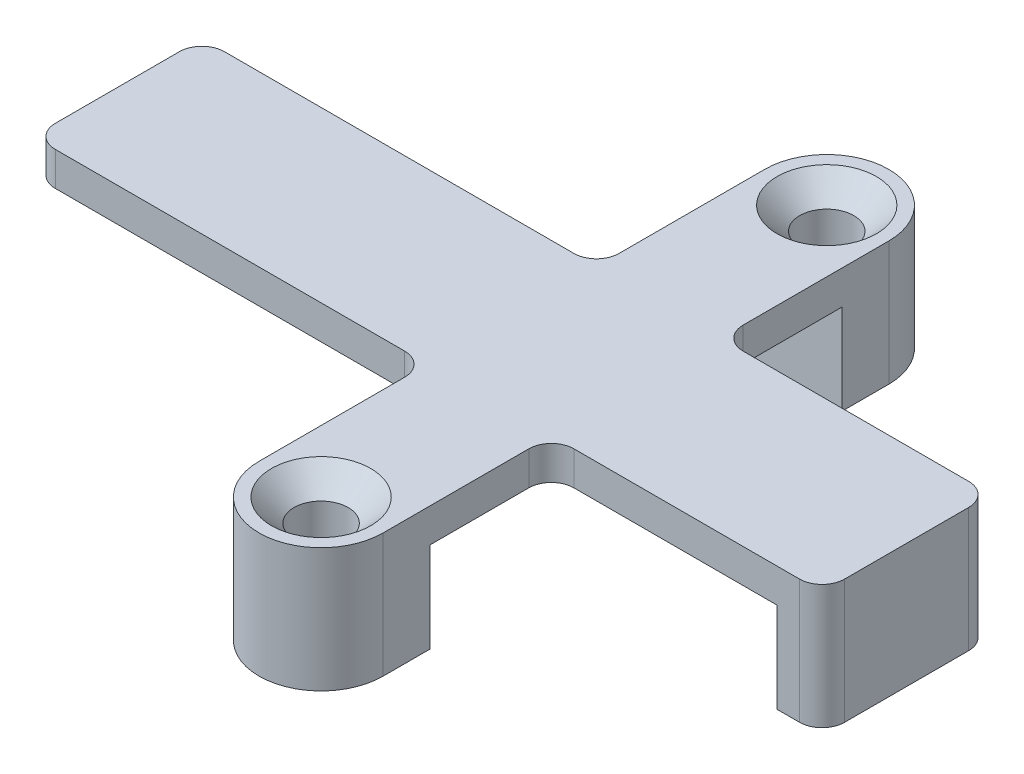
from build123d import *

# Parameters (mm, degrees)
BOSS_EXTRUDE1_DEPTH                            = 1.5
BOSS_EXTRUDE2_START                            = -4
SKETCH1_4_W                                    = 2
SKETCH1_4_H                                    = 7.5
BOSS_EXTRUDE2_DEPTH                            = 4
CSK_FOR_M2_FLAT_HEAD_MACHINE_SCREW1_AT_2_COUNT = 2
CSK_FOR_M2_FLAT_HEAD_MACHINE_SCREW1_AT_2_PITCH = 22.4144
CSK_FOR_M2_FLAT_HEAD_MACHINE_SCREW1_AT_3_COUNT = 2
CSK_FOR_M2_FLAT_HEAD_MACHINE_SCREW1_AT_3_PITCH = 22.4144
FILLET1_R                                      = 1


with BuildPart() as part:
    # Sketch1 → Boss-Extrude1 (new body)
    with BuildSketch(Plane(origin=(0, 0, 0), x_dir=(1, 0, 0), z_dir=(0, 1, 0))):
        with BuildLine():
            ThreePointArc((2.75, 11.2072), (0, 13.9572), (-2.75, 11.2072))
            Line((-2.75, 11.2072), (-2.75, 3.75))
            Line((-2.75, 3.75), (-20.24, 3.75))
            Line((-20.24, 3.75), (-20.24, -3.75))
            Line((-20.24, -3.75), (-2.75, -3.75))
            Line((-2.75, -3.75), (-2.75, -11.2072))
            ThreePointArc((-2.75, -11.2072), (0, -13.9572), (2.75, -11.2072))
            Line((2.75, -11.2072), (2.75, -3.75))
            Line((2.75, -3.75), (14.75, -3.75))
            Line((14.75, -3.75), (14.75, 3.75))
            Line((14.75, 3.75), (2.75, 3.75))
            Line((2.75, 3.75), (2.75, 11.2072))
        make_face()
    extrude(amount=BOSS_EXTRUDE1_DEPTH)

    # Sketch1<4> → Boss-Extrude2 (add)
    with BuildSketch(Plane(origin=(0, 0, 0), x_dir=(1, 0, 0), z_dir=(0, 1, 0)).offset(BOSS_EXTRUDE2_START)):
        with BuildLine():
            Line((2.75, 9.125), (2.75, 11.2072))
            ThreePointArc((2.75, 11.2072), (0, 13.9572), (-2.75, 11.2072))
            Line((-2.75, 11.2072), (-2.75, 9.125))
            Line((-2.75, 9.125), (2.75, 9.125))
        make_face()
        with Locations((13.75, 0)):
            Rectangle(SKETCH1_4_W, SKETCH1_4_H)
        with BuildLine():
            Line((2.75, -11.2072), (2.75, -9.125))
            Line((2.75, -9.125), (-2.75, -9.125))
            Line((-2.75, -9.125), (-2.75, -11.2072))
            ThreePointArc((-2.75, -11.2072), (0, -13.9572), (2.75, -11.2072))
        make_face()
    extrude(amount=BOSS_EXTRUDE2_DEPTH)

    # Sketch3 → CSK for M2 Flat Head Machine Screw1 (revolve, cut)
    with BuildSketch(Plane(origin=(0, 1.5, 11.2072), x_dir=(0, 0, 1), z_dir=(1, 0, 0))):
        Polygon((0, 0), (0, 5.5), (1.2, 5.5), (1.2, 1), (2.2, 0), align=None)
    csk_for_m2_flat_head_machine_screw1 = revolve(axis=Axis((0, 7.85, 11.2072), (0, -1, 0)), mode=Mode.SUBTRACT)

    # CSK for M2 Flat Head Machine Screw1 at 2: CSK for M2 Flat Head Machine Screw1 ×2
    with Locations(*[(0, 0, -i * CSK_FOR_M2_FLAT_HEAD_MACHINE_SCREW1_AT_2_PITCH) for i in range(1, CSK_FOR_M2_FLAT_HEAD_MACHINE_SCREW1_AT_2_COUNT)]):
        add(csk_for_m2_flat_head_machine_screw1, mode=Mode.SUBTRACT)

    # CSK for M2 Flat Head Machine Screw1 at 3: CSK for M2 Flat Head Machine Screw1 ×2
    with Locations(*[(0, 0, -i * CSK_FOR_M2_FLAT_HEAD_MACHINE_SCREW1_AT_3_PITCH) for i in range(1, CSK_FOR_M2_FLAT_HEAD_MACHINE_SCREW1_AT_3_COUNT)]):
        add(csk_for_m2_flat_head_machine_screw1, mode=Mode.SUBTRACT)

    # Fillet1
    fillet1_edges = [part.edges().sort_by_distance(p)[0] for p in [
        (14.75, -1.25, 3.75),
        (2.75, 0.75, 3.75),
        (-2.75, 0.75, 3.75),
        (-20.24, 0.75, 3.75),
        (-20.24, 0.75, -3.75),
        (2.75, 0.75, -3.75),
        (14.75, -1.25, -3.75),
        (-2.75, 0.75, -3.75),
    ]]
    fillet(fillet1_edges, radius=FILLET1_R)


solid = part.part
